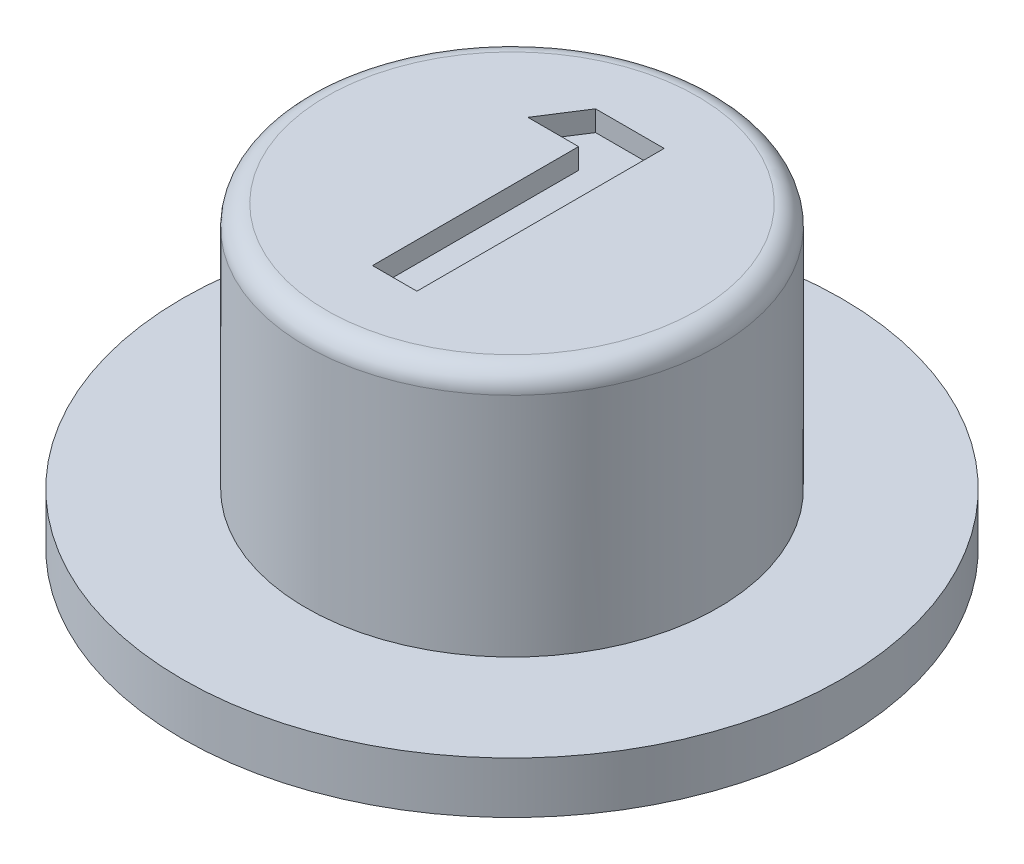
from build123d import *

# Parameters (mm, degrees)
SKETCH2_W          = 2.5
SKETCH2_H          = 3.5
CUT_EXTRUDE1_DEPTH = 3.5
FILLET1_R          = 0.5
CUT_EXTRUDE2_DEPTH = 0.5


with BuildPart() as part:
    # Sketch1 → Revolve1 (revolve)
    with BuildSketch(Plane.XY, mode=Mode.PRIVATE) as revolve1_sk:
        Polygon((0, 7.25), (5, 7.25), (5, 1.25), (8, 1.25), (8, 0), (0, 0), align=None)
    revolve(revolve1_sk.sketch.rotate(Axis((0, 7.25, 0), (0, -1, 0)), 180), axis=Axis((0, 7.25, 0), (0, -1, 0)))

    # Sketch2 → Cut-Extrude1 (cut)
    with BuildSketch(Plane.XZ):
        Rectangle(SKETCH2_W, SKETCH2_H)
    extrude(amount=-CUT_EXTRUDE1_DEPTH, mode=Mode.SUBTRACT)

    # Fillet1
    fillet1_edges = [part.edges().sort_by_distance(p)[0] for p in [
        (5, 7.25, 0),
    ]]
    fillet(fillet1_edges, radius=FILLET1_R)

    # Sketch3 → Cut-Extrude2 (cut)
    with BuildSketch(Plane(origin=(0, 7.25, 0), x_dir=(1, 0, 0), z_dir=(0, 1, 0))):
        Polygon((-0.972355769, 3), (0.692307692, 3), (0.692307692, -3), (-0.384615385, -3), (-0.384615385, 2), (-1.615384615, 2), align=None)
    extrude(amount=-CUT_EXTRUDE2_DEPTH, mode=Mode.SUBTRACT)


solid = part.part
